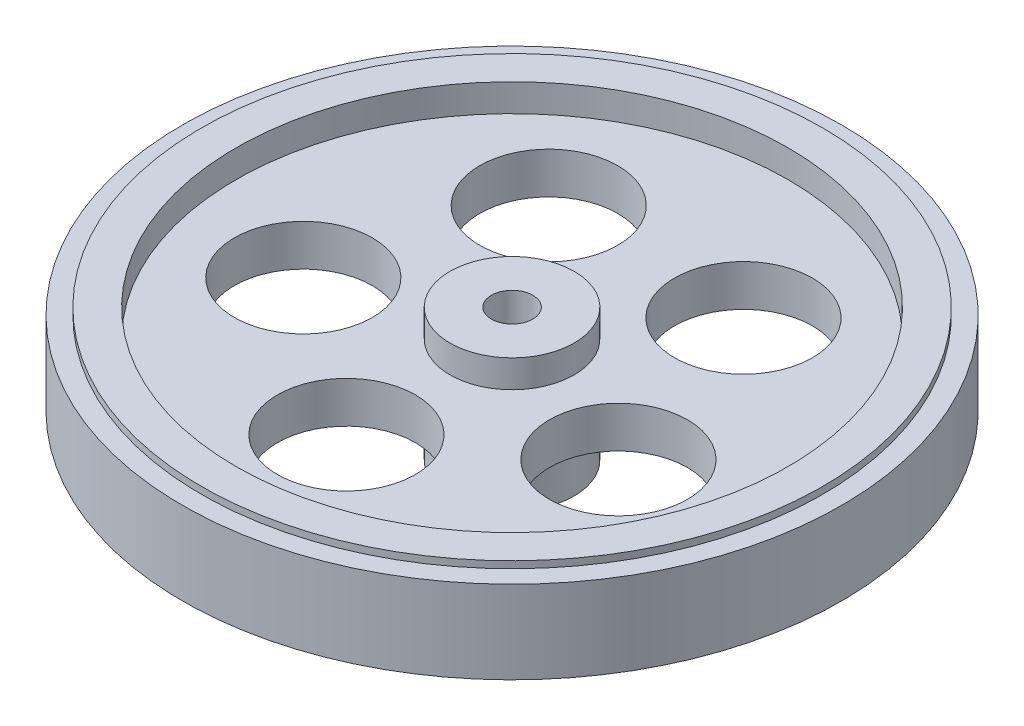
from build123d import *

# Parameters (mm, degrees)
SKETCH_2_R          = 10
CUT_EXTRUDE_1_DEPTH = 10


with BuildPart() as part:
    # 草图1 → 旋转1 (revolve)
    with BuildSketch(Plane.XY, mode=Mode.PRIVATE) as revolve_1_sk:
        Polygon((-3, 33.921052632), (-9, 33.921052632), (-9, 29.921052632), (-40, 29.921052632), (-40, 33.921052632), (-45, 33.921052632), (-45, 32.921052632), (-47.75, 32.921052632), (-47.75, 20.921052632), (-45, 20.921052632), (-45, 19.921052632), (-40, 19.921052632), (-40, 23.921052632), (-9, 23.921052632), (-9, 19.921052632), (-9, 14.721052632), (-3, 14.721052632), align=None)
    revolve(revolve_1_sk.sketch.rotate(Axis((0, 0, 0), (0, 1, 0)), 270), axis=Axis((0, 0, 0), (0, 1, 0)))

    # 草图2 → 切除-拉伸1 (cut)
    with BuildSketch(Plane.XZ.offset(-23.921052632)):
        with Locations(Location((0, 24, 0), (0, 0, 270))):
            Circle(SKETCH_2_R)
        with Locations(Location((22.825356391, 7.416407865, 0), (0, 0, 270))):
            Circle(SKETCH_2_R)
        with Locations(Location((14.106846055, -19.416407865, 0), (0, 0, 270))):
            Circle(SKETCH_2_R)
        with Locations(Location((-14.106846055, -19.416407865, 0), (0, 0, 270))):
            Circle(SKETCH_2_R)
        with Locations(Location((-22.825356391, 7.416407865, 0), (0, 0, 270))):
            Circle(SKETCH_2_R)
    extrude(amount=-CUT_EXTRUDE_1_DEPTH, mode=Mode.SUBTRACT)


solid = part.part
